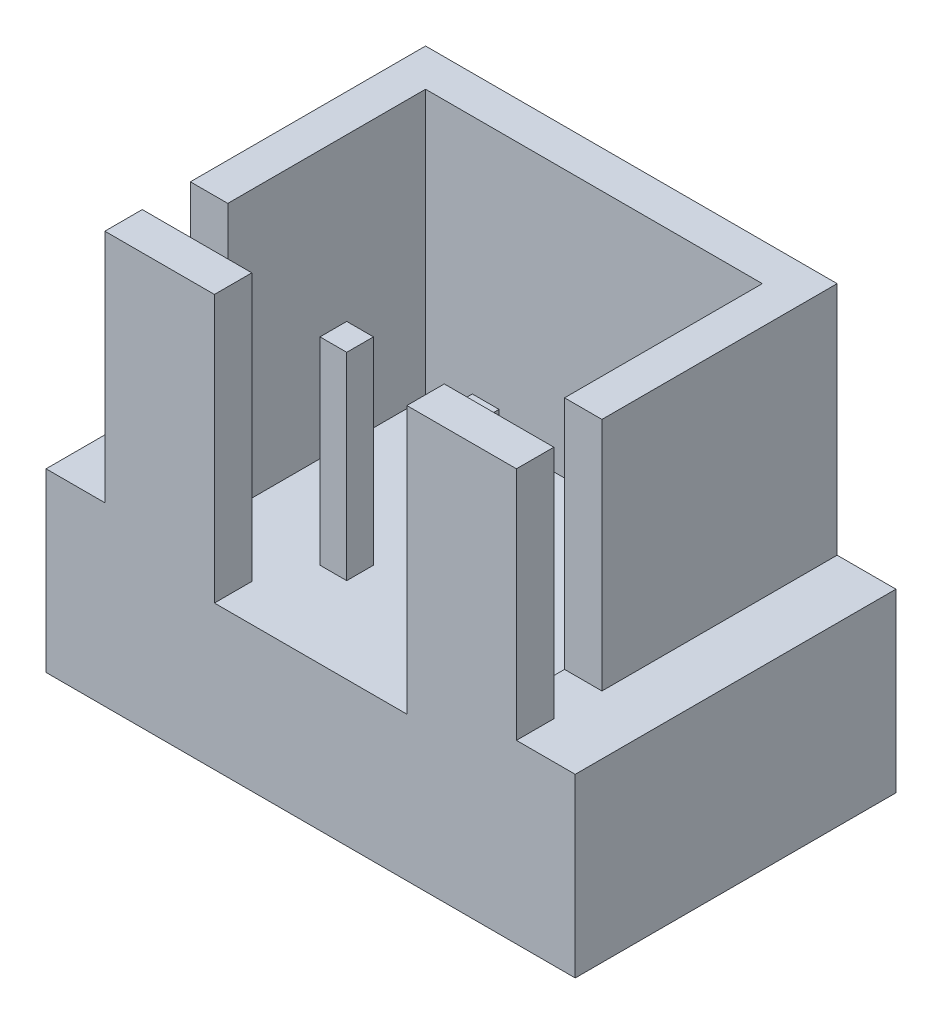
from build123d import *

# Parameters (mm, degrees)
SKETCH1_W           = 9.9
SKETCH1_H           = 6
BOSS_EXTRUDE1_DEPTH = 7.7
SKETCH2_W           = 6.3
SKETCH2_H           = 4.6
CUT_EXTRUDE1_DEPTH  = 5
SKETCH3_W           = 1.1
SKETCH3_H           = 6
CUT_EXTRUDE2_DEPTH  = 4.4
SKETCH4_W           = 3.6
SKETCH4_H           = 0.7
CUT_EXTRUDE3_DEPTH  = 5
SKETCH5_W           = 7.7
SKETCH5_H           = 0.9
CUT_EXTRUDE4_DEPTH  = 4.4
SKETCH6_W           = 0.5
SKETCH6_H           = 0.5
BOSS_EXTRUDE2_DEPTH = 3.7


with BuildPart() as part:
    # Sketch1 → Boss-Extrude1 (new body)
    with BuildSketch(Plane(origin=(0, 0, 0), x_dir=(1, 0, 0), z_dir=(0, 1, 0))):
        Rectangle(SKETCH1_W, SKETCH1_H)
    extrude(amount=BOSS_EXTRUDE1_DEPTH)

    # Sketch2 → Cut-Extrude1 (cut)
    with BuildSketch(Plane(origin=(0, 7.7, 0), x_dir=(1, 0, 0), z_dir=(0, 1, 0))):
        Rectangle(SKETCH2_W, SKETCH2_H)
    extrude(amount=-CUT_EXTRUDE1_DEPTH, mode=Mode.SUBTRACT)

    # Sketch3 → Cut-Extrude2 (cut)
    with BuildSketch(Plane(origin=(0, 7.7, 0), x_dir=(1, 0, 0), z_dir=(0, 1, 0))):
        with Locations((-4.4, 0)):
            Rectangle(SKETCH3_W, SKETCH3_H)
        with Locations((4.4, 0)):
            Rectangle(SKETCH3_W, SKETCH3_H)
    extrude(amount=-CUT_EXTRUDE2_DEPTH, mode=Mode.SUBTRACT)

    # Sketch4 → Cut-Extrude3 (cut)
    with BuildSketch(Plane(origin=(0, 7.7, 0), x_dir=(1, 0, 0), z_dir=(0, 1, 0))):
        with Locations((0, -2.65)):
            Rectangle(SKETCH4_W, SKETCH4_H)
    extrude(amount=-CUT_EXTRUDE3_DEPTH, mode=Mode.SUBTRACT)

    # Sketch5 → Cut-Extrude4 (cut)
    with BuildSketch(Plane(origin=(0, 7.7, 0), x_dir=(1, 0, 0), z_dir=(0, 1, 0))):
        with Locations((0, -1.85)):
            Rectangle(SKETCH5_W, SKETCH5_H)
    extrude(amount=-CUT_EXTRUDE4_DEPTH, mode=Mode.SUBTRACT)

    # Sketch6 → Boss-Extrude2 (add)
    with BuildSketch(Plane(origin=(0, 2.7, 0), x_dir=(1, 0, 0), z_dir=(0, 1, 0))):
        with Locations((-1.175, -1.15)):
            Rectangle(SKETCH6_W, SKETCH6_H)
        with Locations((1.175, -1.15)):
            Rectangle(SKETCH6_W, SKETCH6_H)
    extrude(amount=BOSS_EXTRUDE2_DEPTH)


solid = part.part
